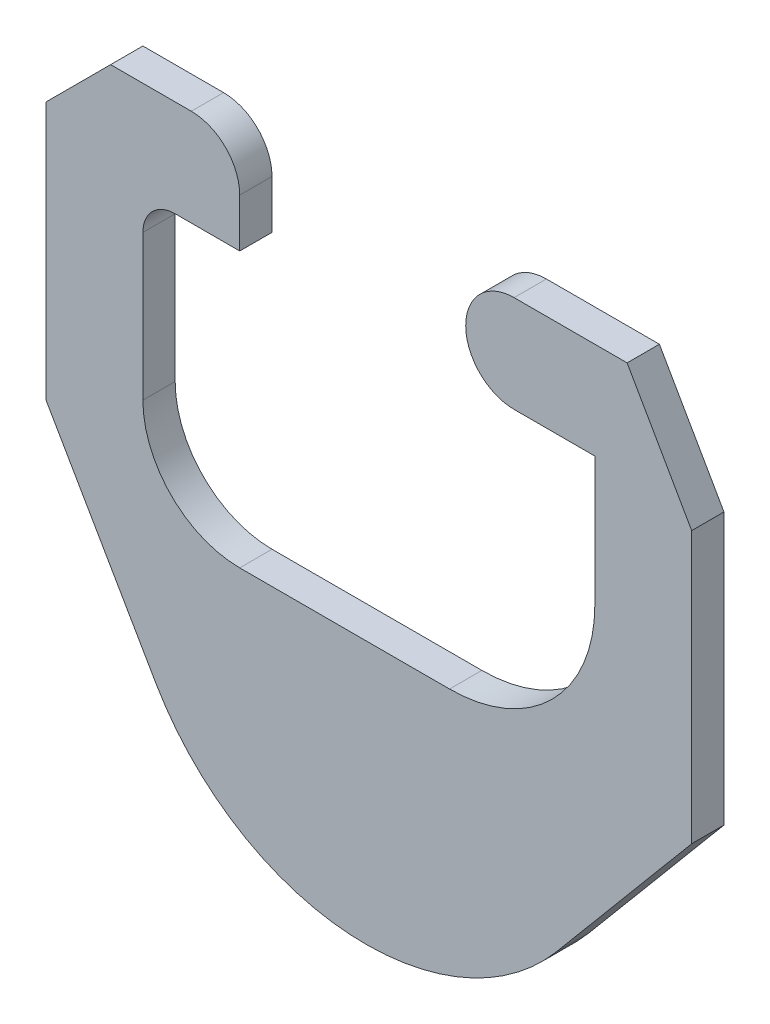
from build123d import *

# Parameters (mm, degrees)
BOSS_EXTRUDE1_DEPTH = 10


with BuildPart() as part:
    # Sketch1 → Boss-Extrude1 (new body)
    with BuildSketch(Plane.XY):
        with BuildLine():
            Line((0, 0), (35, 0))
            Line((35, 0), (55, -35))
            Line((55, -35), (55, -119))
            Line((55, -119), (13.21880537, -168.792888803))
            ThreePointArc((13.21880537, -168.792888803), (-12.876965195, -188.95866594), (-45, -196.425823621))
            ThreePointArc((-45, -196.425823621), (-83.079272466, -186.639009954), (-110.975129822, -158.932803869))
            Line((-110.975129822, -158.932803869), (-145, -100))
            Line((-145, -100), (-145, -20))
            Line((-145, -20), (-125, 0))
            Line((-125, 0), (-100, 0))
            ThreePointArc((-100, 0), (-89.393398282, -4.393398282), (-85, -15))
            Line((-85, -15), (-85, -30))
            Line((-85, -30), (-105, -30))
            ThreePointArc((-105, -30), (-112.071067812, -32.928932188), (-115, -40))
            Line((-115, -40), (-115, -85))
            ThreePointArc((-115, -85), (-106.213203436, -106.213203436), (-85, -115))
            Line((-85, -115), (-20, -115))
            ThreePointArc((-20, -115), (11.819805153, -101.819805153), (25, -70))
            Line((25, -70), (25, -30))
            Line((25, -30), (0, -30))
            ThreePointArc((0, -30), (-15, -15), (0, 0))
        make_face()
    extrude(amount=BOSS_EXTRUDE1_DEPTH)


solid = part.part
